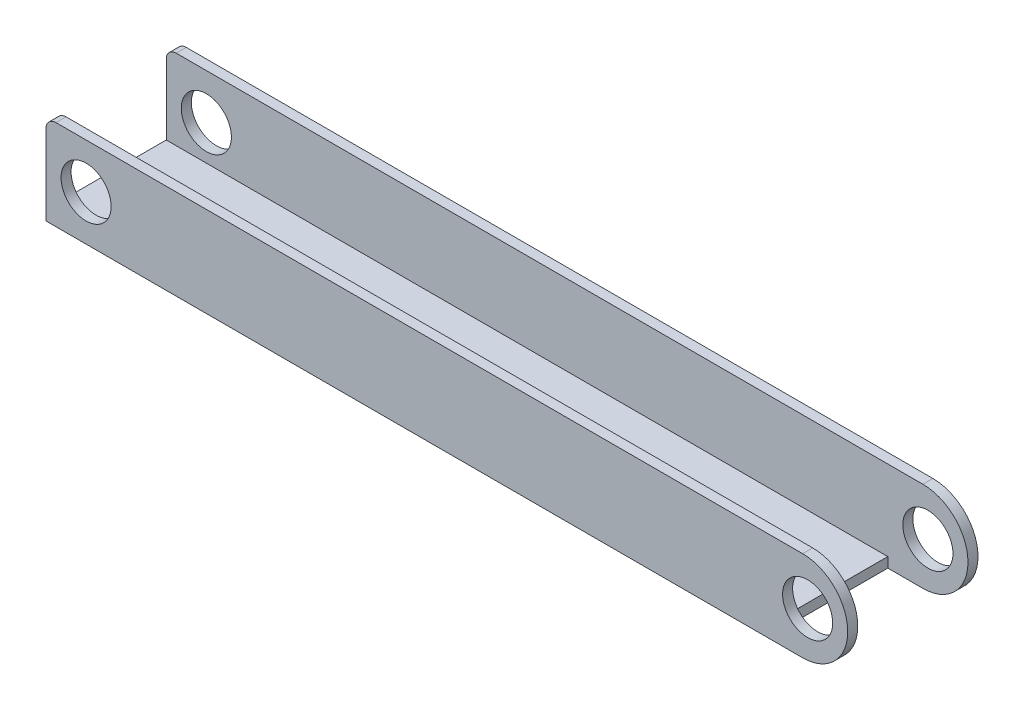
from build123d import *

# Parameters (mm, degrees)
EXTRUDE_THIN1_DEPTH     = 200
CUT_EXTRUDE1_DEPTH      = 207.533895523
CUT_EXTRUDE1_DEPTH_BACK = 207.533895523
SKETCH3_R               = 12.5
FILLET1_R               = 5
SKETCH4_W               = 40
SKETCH4_H               = 55
CUT_EXTRUDE2_DEPTH      = 208.560232222
FILLET2_RADIUS          = 22.5
FILLET2_LENGTH          = 5
FILLET3_RADIUS          = 22.5
FILLET3_LENGTH          = 5


with BuildPart() as part:
    # Sketch1 → Extrude-Thin1 (new, symmetric)
    with BuildSketch(Plane(origin=(0, 0, 0), x_dir=(0, 0, -1), z_dir=(1, 0, 0))):
        Polygon((-27.5, 40), (-27.5, 0), (27.5, 0), (27.5, 40), (32.5, 40), (32.5, -5), (-32.5, -5), (-32.5, 40), align=None)
    extrude(amount=EXTRUDE_THIN1_DEPTH, both=True)

    # Sketch3 → Cut-Extrude1 (cut, two sides: drawn at the far end of the back side and taken through both)
    with BuildSketch(Plane.XY.offset(-CUT_EXTRUDE1_DEPTH_BACK)):
        with Locations((-180, 17.5)):
            Circle(SKETCH3_R)
        with Locations((180, 17.5)):
            Circle(SKETCH3_R)
    extrude(amount=CUT_EXTRUDE1_DEPTH + CUT_EXTRUDE1_DEPTH_BACK, mode=Mode.SUBTRACT)

    # Fillet1
    fillet1_edges = [part.edges().sort_by_distance(p)[0] for p in [
        (-200, 40, 30),
        (-200, 40, -30),
    ]]
    fillet(fillet1_edges, radius=FILLET1_R)

    # Sketch4 → Cut-Extrude2 (cut, through all)
    with BuildSketch(Plane(origin=(0, -5, 0), x_dir=(1, 0, 0), z_dir=(0, 1, 0))):
        with Locations((180, 0)):
            Rectangle(SKETCH4_W, SKETCH4_H)
    extrude(amount=CUT_EXTRUDE2_DEPTH, mode=Mode.SUBTRACT)

    # Fillet2: full round fillet: the end face becomes a half cylinder, R = half its width
    fillet2_face = Plane((200, 17.5, -30), x_dir=(0, 0, -1), z_dir=(1, 0, 0))  # on the end face: x along it, z out of the body
    fillet2_slab = fillet2_face.offset(-FILLET2_RADIUS / 2) * Box(FILLET2_LENGTH, 2 * FILLET2_RADIUS, FILLET2_RADIUS, mode=Mode.PRIVATE)  # the body's end, R deep
    fillet2_round = Plane((177.5, 17.5, -30), x_dir=(1, 0, 0), z_dir=(0, 0, -1)) * Cylinder(FILLET2_RADIUS, FILLET2_LENGTH, mode=Mode.PRIVATE)  # its axis R under the face
    add(fillet2_slab - fillet2_round, mode=Mode.SUBTRACT)

    # Fillet3: full round fillet: the end face becomes a half cylinder, R = half its width
    fillet3_face = Plane((200, 17.5, 30), x_dir=(0, 0, 1), z_dir=(1, 0, 0))  # on the end face: x along it, z out of the body
    fillet3_slab = fillet3_face.offset(-FILLET3_RADIUS / 2) * Box(FILLET3_LENGTH, 2 * FILLET3_RADIUS, FILLET3_RADIUS, mode=Mode.PRIVATE)  # the body's end, R deep
    fillet3_round = Plane((177.5, 17.5, 30), x_dir=(1, 0, 0), z_dir=(0, 0, 1)) * Cylinder(FILLET3_RADIUS, FILLET3_LENGTH, mode=Mode.PRIVATE)  # its axis R under the face
    add(fillet3_slab - fillet3_round, mode=Mode.SUBTRACT)


solid = part.part
